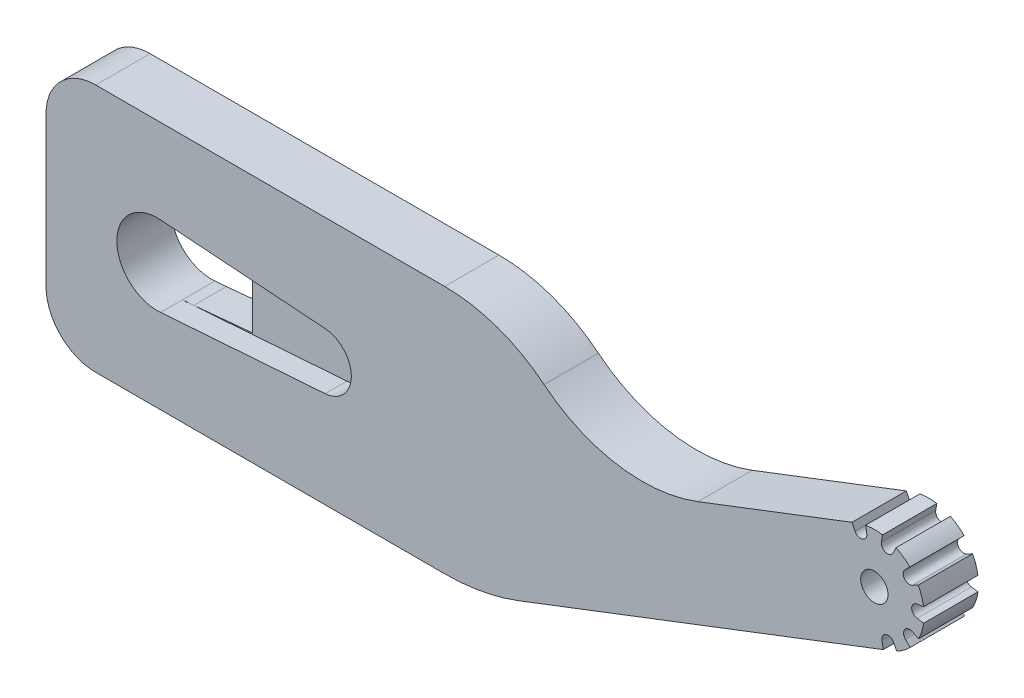
from build123d import *
from build123d.topology import SkipClean

# Parameters (mm, degrees)
CROQUIS1_R              = 1.717841821
CROQUIS1_R_2            = 1.259750669
CROQUIS1_W              = 27.485469141
CROQUIS1_H              = 14.887962451
SALIENTE_EXTRUIR1_DEPTH = 5
SALIENTE_EXTRUIR2_START = -5
SALIENTE_EXTRUIR2_DEPTH = 5
CORTAR_EXTRUIR1_DEPTH   = 5
CORTAR_EXTRUIR2_DEPTH   = 2
CUT_EXTRUDE2_DEPTH      = 83.704538261


with BuildPart() as part:
    # Croquis1 → Saliente-Extruir1 (new body)
    with BuildSketch(Plane(origin=(0, 0, -2.5), x_dir=(-1, 0, 0), z_dir=(0, 0, -1))):
        with BuildLine():
            Line((2.183126414, 10.199004786), (2.457799007, 10.747834714))
            ThreePointArc((2.457799007, 10.747834714), (3.150356623, 11.03498533), (3.533498829, 10.390552574))
            Line((3.533498829, 10.390552574), (3.410556906, 9.704532228))
            Line((3.410556906, 9.704532228), (36.957948904, -3.17310503))
            ThreePointArc((36.957948904, -3.17310503), (40.309989238, -4.118478177), (43.778179918, -4.437160132))
            Line((43.778179918, -4.437160132), (75.884737747, -4.437160132))
            ThreePointArc((75.884737747, -4.437160132), (79.123931349, -3.095442211), (80.46564927, 0.143751392))
            Line((80.46564927, 0.143751392), (80.46564927, 13.886485962))
            ThreePointArc((80.46564927, 13.886485962), (79.123931349, 17.125679564), (75.884737747, 18.467397485))
            Line((75.884737747, 18.467397485), (43.778179918, 18.467397485))
            ThreePointArc((43.778179918, 18.467397485), (38.923372817, 17.631925595), (34.62713443, 15.221634951))
            ThreePointArc((34.62713443, 15.221634951), (27.84817952, 12.197288027), (20.46564927, 12.971336544))
            Line((20.46564927, 12.971336544), (6.293279019, 18.411599775))
            Line((6.293279019, 18.411599775), (6.008822105, 17.843219559))
            ThreePointArc((6.008822105, 17.843219559), (5.316264489, 17.556068943), (4.933122282, 18.200501699))
            Line((4.933122282, 18.200501699), (5.041383533, 18.804603367))
            ThreePointArc((5.041383533, 18.804603367), (4.263160644, 18.876341405), (3.484068945, 18.814751339))
            Line((3.484068945, 18.814751339), (3.584448287, 18.209290101))
            ThreePointArc((3.584448287, 18.209290101), (3.192940304, 17.56990522), (2.504183677, 17.866056933))
            Line((2.504183677, 17.866056933), (2.236686818, 18.418419815))
            ThreePointArc((2.236686818, 18.418419815), (1.564924714, 18.019029169), (0.970828021, 17.511263148))
            Line((0.970828021, 17.511263148), (1.407917802, 17.080436215))
            ThreePointArc((1.407917802, 17.080436215), (1.467002194, 16.333040361), (0.735712768, 16.167791142))
            Line((0.735712768, 16.167791142), (0.194632507, 16.457431391))
            ThreePointArc((0.194632507, 16.457431391), (-0.114078519, 15.739465714), (-0.296255461, 14.9794731))
            Line((-0.296255461, 14.9794731), (0.310591317, 14.887841716))
            ThreePointArc((0.310591317, 14.887841716), (0.797699855, 14.317914702), (0.303205335, 13.754384137))
            Line((0.303205335, 13.754384137), (-0.304784058, 13.670669023))
            ThreePointArc((-0.304784058, 13.670669023), (-0.132526888, 12.9083668), (0.16680132, 12.18643894))
            Line((0.16680132, 12.18643894), (0.711610253, 12.469003179))
            ThreePointArc((0.711610253, 12.469003179), (1.440684032, 12.294237755), (1.371864517, 11.547675365))
            Line((1.371864517, 11.547675365), (0.929197275, 11.122581216))
            ThreePointArc((0.929197275, 11.122581216), (1.516626257, 10.607115987), (2.183126414, 10.199004786))
        make_face()
        with Locations(Location((46.05155145, 7.015118677, 0), (0, 0, 180))):
            Circle(CROQUIS1_R, mode=Mode.SUBTRACT)
        with Locations(Location((77.659840962, 7.015118677, 0), (0, 0, 180))):
            Circle(CROQUIS1_R, mode=Mode.SUBTRACT)
        with Locations(Location((4.233310556, 14.295527136, 0), (0, 0, 180))):
            Circle(CROQUIS1_R_2, mode=Mode.SUBTRACT)
        with Locations((61.855696206, 7.015118677)):
            Rectangle(CROQUIS1_W, CROQUIS1_H, mode=Mode.SUBTRACT)
    extrude(amount=-SALIENTE_EXTRUIR1_DEPTH)

    # Croquis2 → Saliente-Extruir2 (add)
    with BuildSketch(Plane.XY.offset(2.5).offset(SALIENTE_EXTRUIR2_START)):
        with BuildLine():
            Line((-43.778179918, -4.437160132), (-75.884737747, -4.437160132))
            ThreePointArc((-75.884737747, -4.437160132), (-79.123931349, -3.095442211), (-80.46564927, 0.143751392))
            Line((-80.46564927, 0.143751392), (-80.46564927, 13.886485962))
            ThreePointArc((-80.46564927, 13.886485962), (-79.123931349, 17.125679564), (-75.884737747, 18.467397485))
            Line((-75.884737747, 18.467397485), (-43.778179918, 18.467397485))
            Line((-43.778179918, 18.467397485), (-43.778179918, -4.437160132))
        make_face()
    extrude(amount=SALIENTE_EXTRUIR2_DEPTH)

    # Croquis3 → Cortar-Extruir1 (cut)
    with BuildSketch(Plane.XY.offset(2.5)):
        with BuildLine():
            Line((-68.86564927, 10.615118677), (-63.46564927, 10.110118677))
            Line((-63.46564927, 10.110118677), (-63.46564927, 3.920118677))
            Line((-63.46564927, 3.920118677), (-68.86564927, 3.415118677))
            ThreePointArc((-68.86564927, 3.415118677), (-72.46564927, 7.015118677), (-68.86564927, 10.615118677))
        make_face()
    extrude(amount=-CORTAR_EXTRUIR1_DEPTH, mode=Mode.SUBTRACT)

    # Croquis4 → Cortar-Extruir2 (cut)
    with BuildSketch(Plane.XY.offset(2.5)):
        with BuildLine():
            Line((-54.77859891, 9.608381518), (-69.913267682, 10.700035319))
            ThreePointArc((-69.913267682, 10.700035319), (-73.947018097, 7.015118677), (-69.913267682, 3.330202034))
            Line((-69.913267682, 3.330202034), (-54.77859891, 4.421855836))
            ThreePointArc((-54.77859891, 4.421855836), (-52.36564927, 7.015118677), (-54.77859891, 9.608381518))
        make_face()
    extrude(amount=-CORTAR_EXTRUIR2_DEPTH, mode=Mode.SUBTRACT)

    # Sketch2 → Cut-Extrude2 (cut, through all)
    with SkipClean():  # the faces are left unmerged after this step: merging them gives an invalid solid
        with BuildSketch(Plane.XY.offset(0.5)):
            with BuildLine():
                Line((-69.913267682, 10.700035319), (-68.86564927, 10.615118677))
                ThreePointArc((-68.86564927, 10.615118677), (-72.46564927, 7.015118677), (-68.86564927, 3.415118677))
                Line((-68.86564927, 3.415118677), (-69.913267682, 3.330202034))
                ThreePointArc((-69.913267682, 3.330202034), (-73.947018097, 7.015118677), (-69.913267682, 10.700035319))
            make_face()
        extrude(amount=-CUT_EXTRUDE2_DEPTH, mode=Mode.SUBTRACT)


solid = part.part
